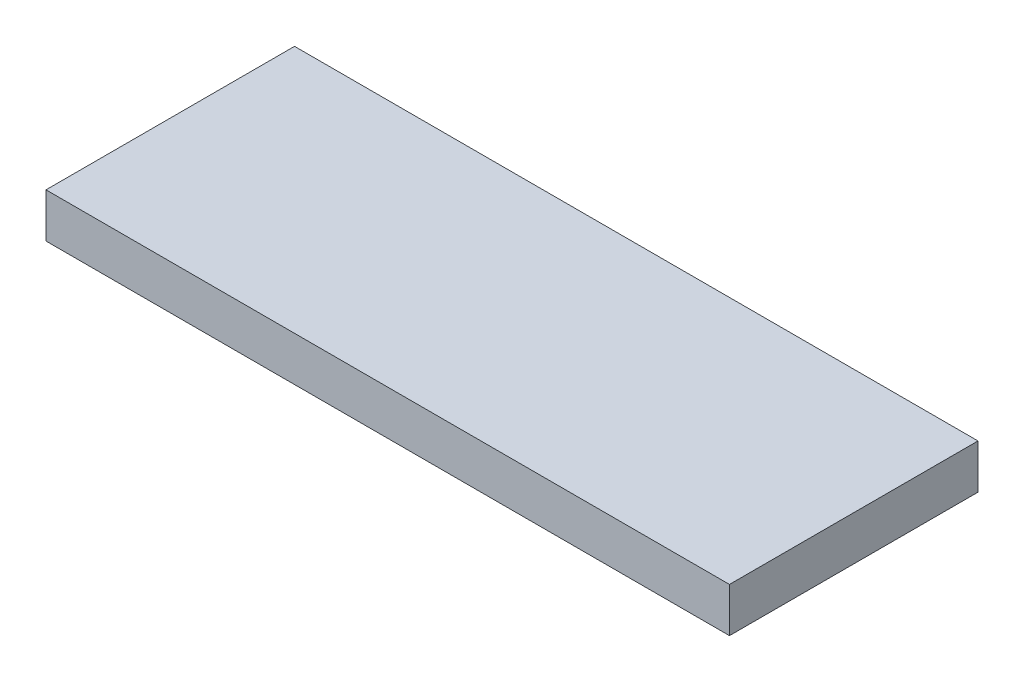
from build123d import *

# Parameters (mm, degrees)
SKETCH1_W  = 154
SKETCH1_H  = 56
BASE_DEPTH = 10


with BuildPart() as part:
    # Sketch1 → base (new body)
    with BuildSketch(Plane(origin=(0, 0, 0), x_dir=(1, 0, 0), z_dir=(0, 1, 0))):
        Rectangle(SKETCH1_W, SKETCH1_H)
    extrude(amount=BASE_DEPTH)

    # Sketch4 → Cut-Revolve1 (revolve, cut)
    with BuildSketch(Plane(origin=(0, 0, 0), x_dir=(0, 0, -1), z_dir=(1, 0, 0)), mode=Mode.PRIVATE) as cut_revolve1_sk:
        Polygon((3, 0), (3, 2), (0, 3.732050808), (0, 0), align=None)
    revolve(cut_revolve1_sk.sketch.rotate(Axis((0, 3.732050808, 0), (0, -1, 0)), 180), axis=Axis((0, 3.732050808, 0), (0, -1, 0)), mode=Mode.SUBTRACT)


solid = part.part
